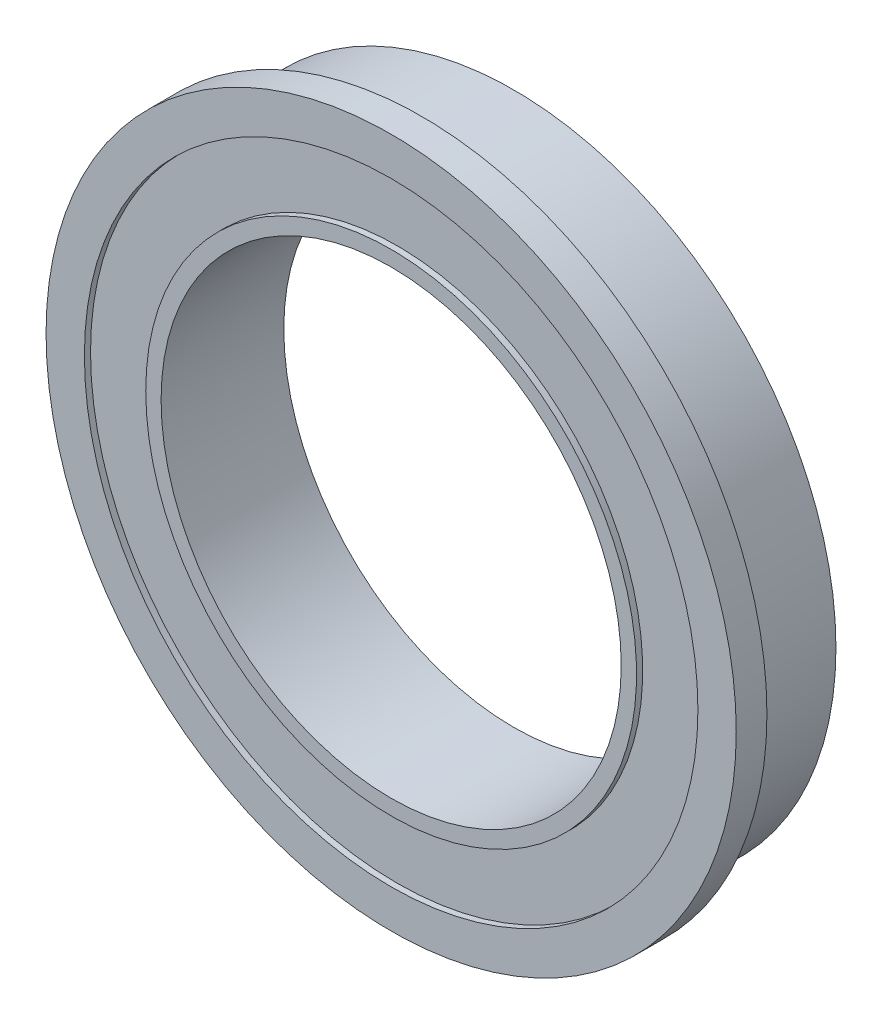
from build123d import *

# Parameters (mm, degrees)
SKETCH_1_R          = 11.25
SKETCH_1_R_2        = 10.5
EXTRUDE_1_DEPTH     = 1
EXTRUDE_START       = -4
SKETCH_2_R          = 10.5
SKETCH_2_R_2        = 7.5
EXTRUDE_2_DEPTH     = 4
SKETCH_3_R          = 10
SKETCH_3_R_2        = 8
CUT_EXTRUDE_1_DEPTH = 0.2


with BuildPart() as part:
    # 草图1 → 凸台-拉伸1 (new body)
    with BuildSketch(Plane.XY):
        Circle(SKETCH_1_R)
        Circle(SKETCH_1_R_2, mode=Mode.SUBTRACT)
    extrude(amount=EXTRUDE_1_DEPTH)

    # 草图2 → 凸台-拉伸2 (add)
    with BuildSketch(Plane.XY.offset(1).offset(EXTRUDE_START)):
        Circle(SKETCH_2_R)
        Circle(SKETCH_2_R_2, mode=Mode.SUBTRACT)
    extrude(amount=EXTRUDE_2_DEPTH)

    # 草图3 → 切除-拉伸1 (cut)
    with BuildSketch(Plane(origin=(0, 0, -3), x_dir=(-1, 0, 0), z_dir=(0, 0, -1))):
        Circle(SKETCH_3_R)
        Circle(SKETCH_3_R_2, mode=Mode.SUBTRACT)
    cut_extrude_1 = extrude(amount=-CUT_EXTRUDE_1_DEPTH, mode=Mode.SUBTRACT)

    # 镜向1: 切除-拉伸1 across plane
    add(cut_extrude_1.mirror(Plane(origin=(0, 0, -1), x_dir=(1, 0, 0), z_dir=(0, 0, -1))), mode=Mode.SUBTRACT)


solid = part.part
